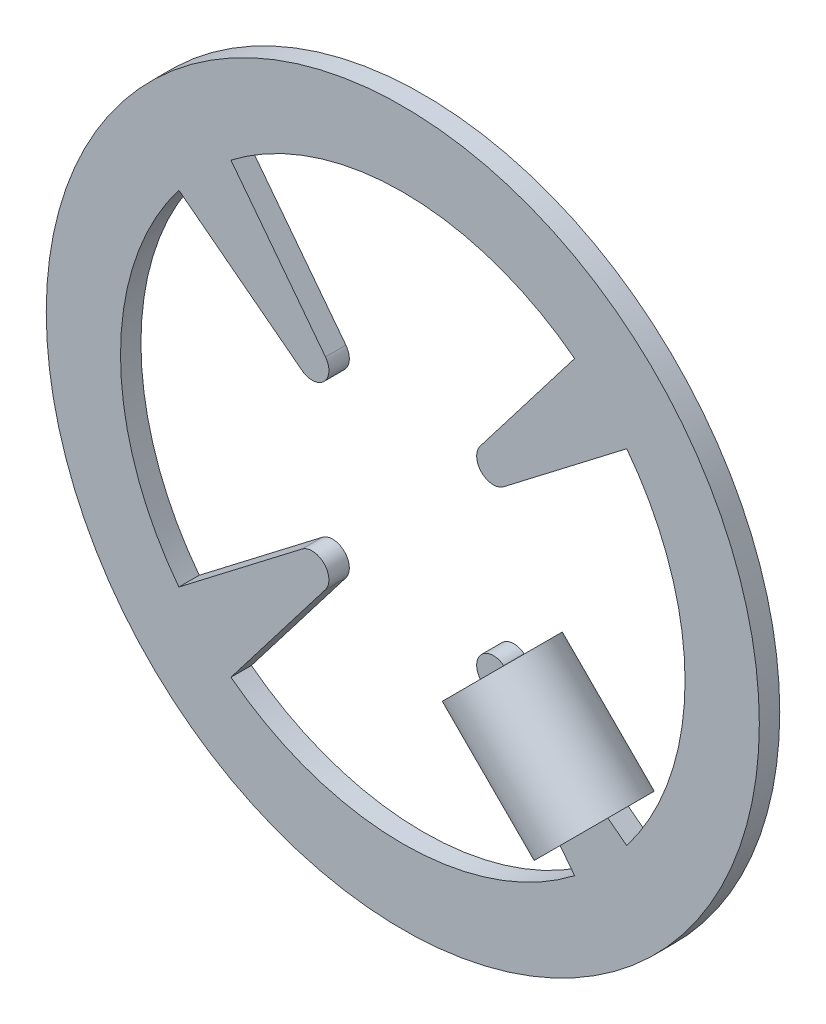
from build123d import *

# Parameters (mm, degrees)
SKETCH_1_R      = 0.96
SKETCH_1_R_2    = 0.76
EXTRUDE_1_DEPTH = 0.055
EXTRUDE_START   = -0.055
EXTRUDE_2_DEPTH = 0.055
SKETCH_66_R     = 0.132
SKETCH_66_R_2   = 0.1
EXTRUDE_3_DEPTH = 0.35


with BuildPart() as part:
    # 草圖1 → 填料-伸長1 (new body)
    with BuildSketch(Plane.XY):
        Circle(SKETCH_1_R)
        Circle(SKETCH_1_R_2, mode=Mode.SUBTRACT)
    extrude(amount=EXTRUDE_1_DEPTH)

    # 草圖2 → 填料-伸長2 (add)
    with BuildSketch(Plane.XY.offset(0.055).offset(EXTRUDE_START)):
        with BuildLine():
            Line((-0.208247811, 0.271393831), (-0.462658686, 0.602948539))
            ThreePointArc((-0.462658686, 0.602948539), (-0.537401154, 0.537401154), (-0.602948539, 0.462658686))
            Line((-0.602948539, 0.462658686), (-0.271393831, 0.208247811))
            ThreePointArc((-0.271393831, 0.208247811), (-0.241031974, 0.199037642), (-0.212132034, 0.212132034))
            ThreePointArc((-0.212132034, 0.212132034), (-0.199037642, 0.241031974), (-0.208247811, 0.271393831))
        make_face()
        with BuildLine():
            ThreePointArc((0.208247811, 0.271393831), (0.199037642, 0.241031974), (0.212132034, 0.212132034))
            ThreePointArc((0.212132034, 0.212132034), (0.241031974, 0.199037642), (0.271393831, 0.208247811))
            Line((0.271393831, 0.208247811), (0.602948539, 0.462658686))
            ThreePointArc((0.602948539, 0.462658686), (0.537401154, 0.537401154), (0.462658686, 0.602948539))
            Line((0.462658686, 0.602948539), (0.208247811, 0.271393831))
        make_face()
        with BuildLine():
            ThreePointArc((0.271393831, -0.208247811), (0.241031974, -0.199037642), (0.212132034, -0.212132034))
            ThreePointArc((0.212132034, -0.212132034), (0.199037642, -0.241031974), (0.208247811, -0.271393831))
            Line((0.208247811, -0.271393831), (0.462658686, -0.602948539))
            ThreePointArc((0.462658686, -0.602948539), (0.537401154, -0.537401154), (0.602948539, -0.462658686))
            Line((0.602948539, -0.462658686), (0.271393831, -0.208247811))
        make_face()
        with BuildLine():
            ThreePointArc((-0.208247811, -0.271393831), (-0.199037642, -0.241031974), (-0.212132034, -0.212132034))
            ThreePointArc((-0.212132034, -0.212132034), (-0.241031974, -0.199037642), (-0.271393831, -0.208247811))
            Line((-0.271393831, -0.208247811), (-0.602948539, -0.462658686))
            ThreePointArc((-0.602948539, -0.462658686), (-0.537401154, -0.537401154), (-0.462658686, -0.602948539))
            Line((-0.462658686, -0.602948539), (-0.208247811, -0.271393831))
        make_face()
    extrude(amount=EXTRUDE_2_DEPTH)


with BuildPart() as body_2:
    # 草圖66 → 填料-伸長3 (new body)
    with BuildSketch(Plane(origin=(0.240416306, -0.240416306, 0), x_dir=(0.7071067811865477, 0.7071067811865475, 0), z_dir=(0.7071067811865475, -0.7071067811865477, 0))):
        with Locations((0, 0.0275)):
            Circle(SKETCH_66_R)
        with Locations((0, 0.0275)):
            Circle(SKETCH_66_R_2, mode=Mode.SUBTRACT)
    extrude(amount=EXTRUDE_3_DEPTH)


solid = Compound([part.part, body_2.part])
